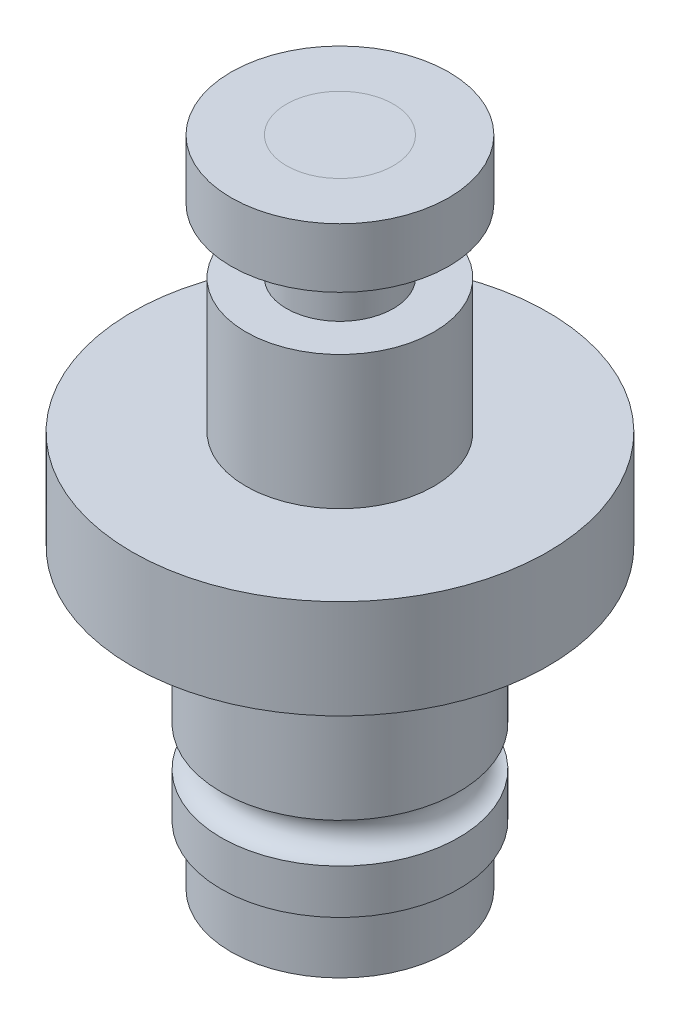
from build123d import *

# Parameters (mm, degrees)
BOSS_EXTRUDE1_DEPTH      = 2.5
BOSS_EXTRUDE1_DEPTH_BACK = 2.5
SKETCH1_R                = 10.5
SKETCH2_R                = 4.75
BOSS_EXTRUDE2_DEPTH      = 6.75
SKETCH3_R                = 2.7
BOSS_EXTRUDE4_DEPTH      = 6.25
SKETCH5_R                = 5.5
SKETCH5_R_2              = 2.7
BOSS_EXTRUDE5_DEPTH      = 3
SKETCH6_R                = 2.5
BOSS_EXTRUDE6_DEPTH      = 15
SKETCH7_R                = 4.875
SKETCH7_R_2              = 2.5
BOSS_EXTRUDE7_DEPTH      = 1
SKETCH8_R                = 6
SKETCH8_R_2              = 2.5
BOSS_EXTRUDE8_DEPTH      = 11
SKETCH9_R                = 1
SKETCH10_R               = 5.5
SKETCH10_R_2             = 2.5
BOSS_EXTRUDE12_DEPTH     = 3


with BuildPart() as part:
    # Sketch1 → Boss-Extrude1 (new, two sides: drawn at the far end of the back side and taken through both)
    with BuildSketch(Plane(origin=(0, 0, 0), x_dir=(1, 0, 0), z_dir=(0, 1, 0)).offset(-BOSS_EXTRUDE1_DEPTH_BACK)):
        with Locations(Location((0, 0, 0), (0, 0, 270))):
            Circle(SKETCH1_R)
    extrude(amount=BOSS_EXTRUDE1_DEPTH + BOSS_EXTRUDE1_DEPTH_BACK)

    # Sketch2 → Boss-Extrude2 (add)
    with BuildSketch(Plane(origin=(0, 2.5, 0), x_dir=(1, 0, 0), z_dir=(0, 1, 0))):
        with Locations(Location((0, 0, 0), (0, 0, 270))):
            Circle(SKETCH2_R)
    extrude(amount=BOSS_EXTRUDE2_DEPTH)

    # Sketch3 → Boss-Extrude4 (add)
    with BuildSketch(Plane(origin=(0, 9.25, 0), x_dir=(1, 0, 0), z_dir=(0, 1, 0))):
        with Locations(Location((0, 0, 0), (0, 0, 270))):
            Circle(SKETCH3_R)
    extrude(amount=BOSS_EXTRUDE4_DEPTH)


with BuildPart() as body_2:
    # Sketch5 → Boss-Extrude5 (new body)
    with BuildSketch(Plane(origin=(0, 15.5, 0), x_dir=(1, 0, 0), z_dir=(0, 1, 0))):
        with Locations(Location((0, 0, 0), (0, 0, 270))):
            Circle(SKETCH5_R)
        with Locations(Location((0, 0, 0), (0, 0, 270))):
            Circle(SKETCH5_R_2, mode=Mode.SUBTRACT)
    extrude(amount=-BOSS_EXTRUDE5_DEPTH)


with BuildPart() as body_3:
    # Sketch6 → Boss-Extrude6 (new body)
    with BuildSketch(Plane.XZ.offset(2.5)):
        with Locations(Location((0, 0, 0), (0, 0, 270))):
            Circle(SKETCH6_R)
    extrude(amount=BOSS_EXTRUDE6_DEPTH)


with BuildPart() as body_4:
    # Sketch7 → Boss-Extrude7 (new body)
    with BuildSketch(Plane.XZ.offset(2.5)):
        with Locations(Location((0, 0, 0), (0, 0, 270))):
            Circle(SKETCH7_R)
        with Locations(Location((0, 0, 0), (0, 0, 270))):
            Circle(SKETCH7_R_2, mode=Mode.SUBTRACT)
    extrude(amount=BOSS_EXTRUDE7_DEPTH)


with BuildPart() as body_5:
    # Sketch8 → Boss-Extrude8 (new body)
    with BuildSketch(Plane.XZ.offset(3.5)):
        with Locations(Location((0, 0, 0), (0, 0, 270))):
            Circle(SKETCH8_R)
        with Locations(Location((0, 0, 0), (0, 0, 270))):
            Circle(SKETCH8_R_2, mode=Mode.SUBTRACT)
    extrude(amount=BOSS_EXTRUDE8_DEPTH)

    # Sketch9 → Cut-Revolve1 (revolve, cut)
    with BuildSketch(Plane.XY, mode=Mode.PRIVATE) as cut_revolve1_sk:
        with Locations((6, -11.25)):
            Circle(SKETCH9_R)
    revolve(cut_revolve1_sk.sketch.rotate(Axis((0, -29.718418544, 0), (0, 1, 0)), 270), axis=Axis((0, -29.718418544, 0), (0, 1, 0)), mode=Mode.SUBTRACT)


with BuildPart() as body_6:
    # Sketch10 → Boss-Extrude12 (new body)
    with BuildSketch(Plane.XZ.offset(14.5)):
        with Locations(Location((0, 0, 0), (0, 0, 270))):
            Circle(SKETCH10_R)
        with Locations(Location((0, 0, 0), (0, 0, 270))):
            Circle(SKETCH10_R_2, mode=Mode.SUBTRACT)
    extrude(amount=BOSS_EXTRUDE12_DEPTH)


solid = Compound([part.part, body_2.part, body_3.part, body_4.part, body_5.part, body_6.part])
